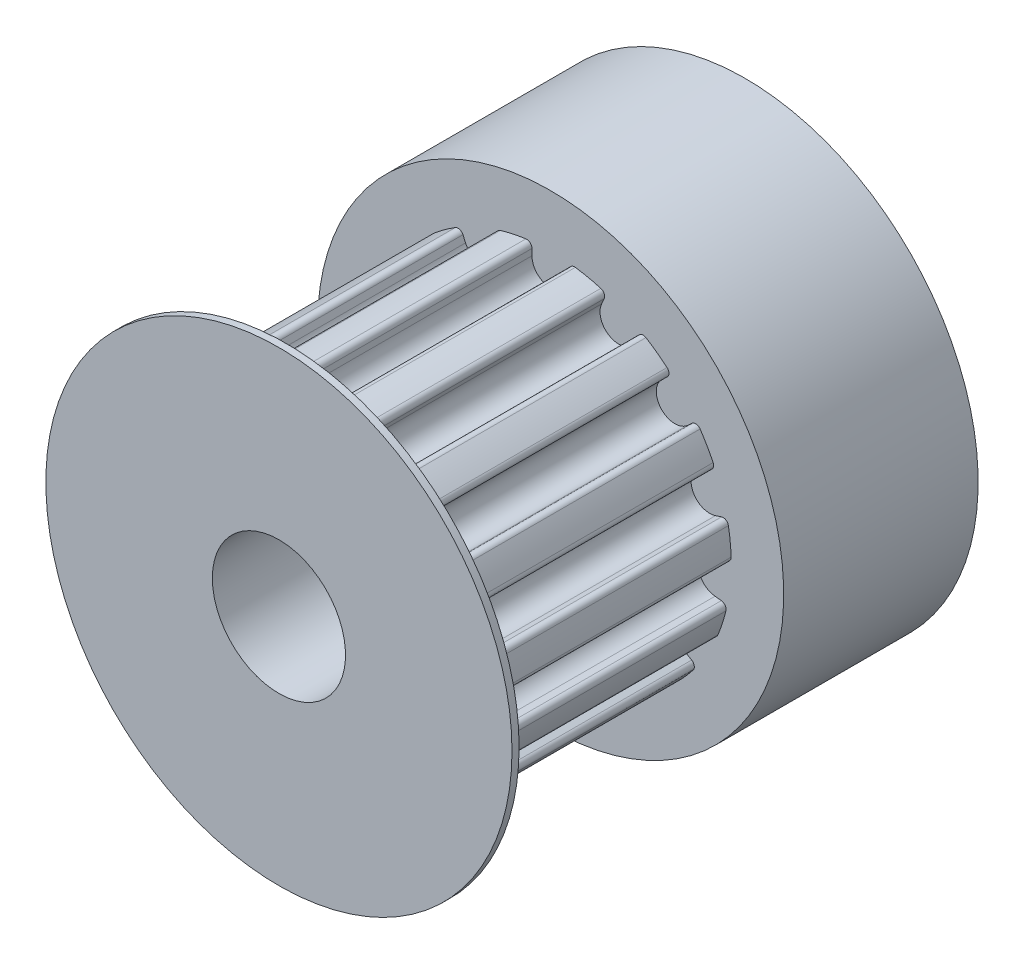
from build123d import *

# Parameters (mm, degrees)
SKETCH5_W           = 10.2
SKETCH5_H           = 6.78
SKETCH16_W          = 7.3
SKETCH16_H          = 8.75
CUT_TOOTH_START     = -10.2
CUT_TOOTH_DEPTH     = 10.2
PATTERN_TOOTH_COUNT = 15
SKETCH_1_R          = 2.5
CUT_EXTRUDE_1_DEPTH = 20
SKETCH_2_R          = 1
CUT_EXTRUDE_2_DEPTH = 10


with BuildPart() as part:
    # Sketch5 → body (revolve)
    with BuildSketch(Plane(origin=(0, 0, 0), x_dir=(0, 0, -1), z_dir=(1, 0, 0)), mode=Mode.PRIVATE) as body_sk:
        with Locations((5.1, 3.39)):
            Rectangle(SKETCH5_W, SKETCH5_H)
    revolve(body_sk.sketch.rotate(Axis((0, 0, 0), (0, 0, -1)), 90), axis=Axis((0, 0, 0), (0, 0, -1)))

    # Sketch16 → body-hub (revolve)
    with BuildSketch(Plane(origin=(0, 0, 0), x_dir=(0, 0, -1), z_dir=(1, 0, 0)), mode=Mode.PRIVATE) as body_hub_sk:
        with Locations((13.85, 4.375)):
            Rectangle(SKETCH16_W, SKETCH16_H)
    revolve(body_hub_sk.sketch.rotate(Axis((0, 0, -17.5), (0, 0, 1)), 90), axis=Axis((0, 0, -17.5), (0, 0, 1)))

    # Sketch23 → cut-tooth (cut)
    with BuildSketch(Plane.XY.offset(CUT_TOOTH_START)):
        with BuildLine():
            Line((0.7, 6.28), (0.7, 6.518159249))
            ThreePointArc((0.7, 6.518159249), (0.768605793, 6.668942413), (0.927355623, 6.716279591))
            Line((0.927355623, 6.716279591), (0.927355623, 7.852559183))
            Line((0.927355623, 7.852559183), (-0.927355623, 7.852559183))
            Line((-0.927355623, 7.852559183), (-0.927355623, 6.716279591))
            ThreePointArc((-0.927355623, 6.716279591), (-0.768605793, 6.668942413), (-0.7, 6.518159249))
            Line((-0.7, 6.518159249), (-0.7, 6.28))
            ThreePointArc((-0.7, 6.28), (0, 5.58), (0.7, 6.28))
        make_face()
    cut_tooth = extrude(amount=CUT_TOOTH_DEPTH, mode=Mode.SUBTRACT)

    # pattern-tooth: cut-tooth ×15 about axis
    pattern_tooth_axis = Axis((0, 0, -10.2), (0, 0, 1))
    for i in range(1, PATTERN_TOOTH_COUNT):
        add(cut_tooth.rotate(pattern_tooth_axis, i * 360 / PATTERN_TOOTH_COUNT), mode=Mode.SUBTRACT)

    # Sketch25 → body-flange-front (revolve)
    with BuildSketch(Plane(origin=(0, 0, 0), x_dir=(0, 0, -1), z_dir=(1, 0, 0)), mode=Mode.PRIVATE) as body_flange_front_sk:
        Polygon((0.5, 3.392), (0, 3.392), (0, 6.964), (0, 8.75), (0.5, 8.75), (0.5, 6.964), align=None)
    revolve(body_flange_front_sk.sketch.rotate(Axis((0, 0, 0), (0, 0, -1)), 90), axis=Axis((0, 0, 0), (0, 0, -1)))

    # Sketch28 → body-flange-profile-front (revolve, cut)
    with BuildSketch(Plane(origin=(0, 0, 0), x_dir=(0, 0, -1), z_dir=(1, 0, 0)), mode=Mode.PRIVATE) as body_flange_profile_front_sk:
        Polygon((0.5, 8.75), (0.5, 8.25), (0.266846171, 8.75), align=None)
    revolve(body_flange_profile_front_sk.sketch.rotate(Axis((0, 0, -10.2), (0, 0, 1)), 90), axis=Axis((0, 0, -10.2), (0, 0, 1)), mode=Mode.SUBTRACT)

    # 草图1 → 切除-拉伸1 (cut)
    with BuildSketch(Plane(origin=(0, 0, -17.5), x_dir=(-1, 0, 0), z_dir=(0, 0, -1))):
        Circle(SKETCH_1_R)
    extrude(amount=-CUT_EXTRUDE_1_DEPTH, mode=Mode.SUBTRACT)

    # 草图2 → 切除-拉伸2 (cut)
    with BuildSketch(Plane(origin=(0, 0, 0), x_dir=(1, 0, 0), z_dir=(0, 1, 0))):
        with Locations(Location((0, 14, 0), (0, 0, 270))):
            Circle(SKETCH_2_R)
    extrude(amount=-CUT_EXTRUDE_2_DEPTH, mode=Mode.SUBTRACT)


solid = part.part
